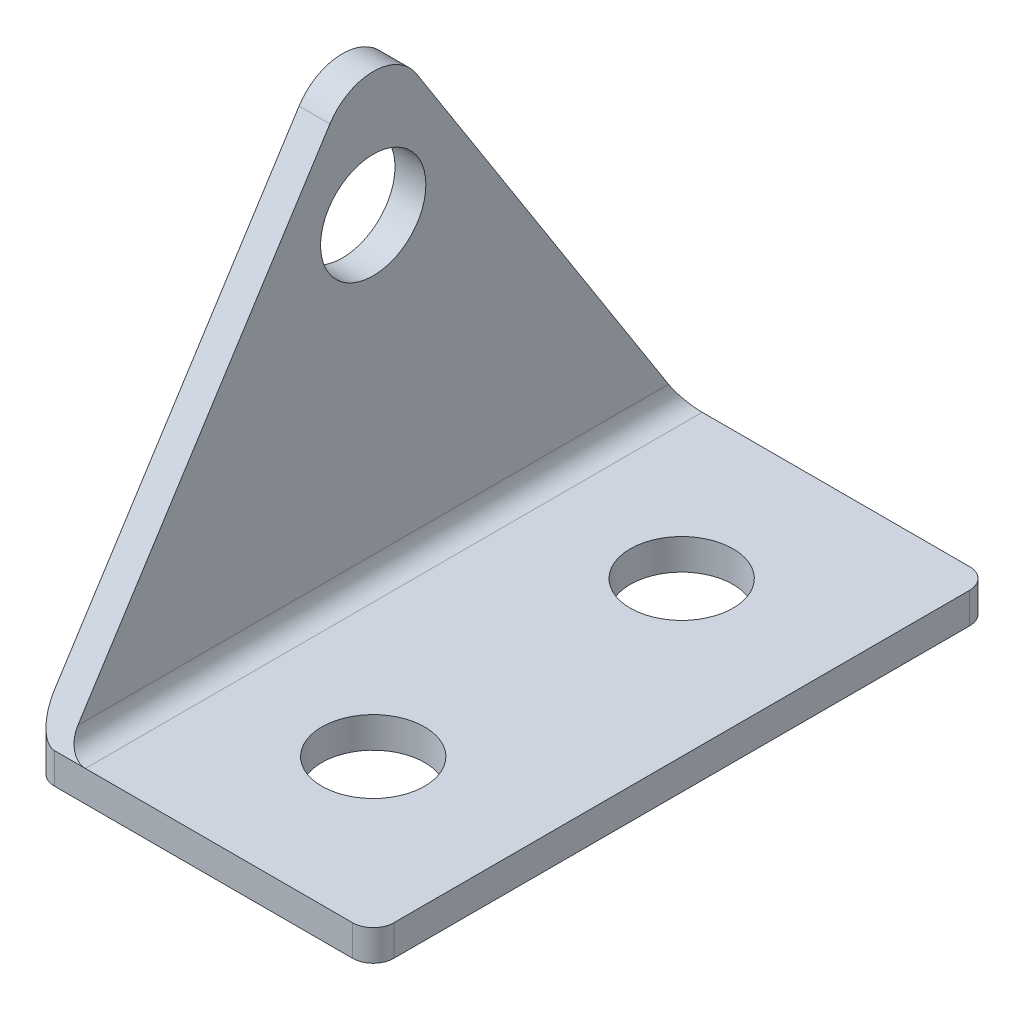
from build123d import *

# Parameters (mm, degrees)
BOSS_EXTRUDE1_DEPTH = 38.1
CUT_EXTRUDE2_DEPTH  = 76.2
FILLET1_R           = 6.35
SKETCH10_W          = 21.59
SKETCH10_H          = 76.2
CUT_EXTRUDE3_DEPTH  = 76.2
FILLET2_R           = 2.54
FILLET3_R           = 2.54
SKETCH11_R          = 6.5024
CUT_EXTRUDE4_DEPTH  = 76.2
SKETCH12_R          = 6.35
CUT_EXTRUDE5_DEPTH  = 76.2


with BuildPart() as part:
    # Sketch7 → Boss-Extrude1 (new, symmetric)
    with BuildSketch(Plane.XY):
        Polygon((0, 0), (0, 63.5), (3.81, 63.5), (3.81, 3.81), (63.5, 3.81), (63.5, 0), align=None)
    extrude(amount=BOSS_EXTRUDE1_DEPTH, both=True)

    # Sketch8 → Cut-Extrude2 (cut)
    with BuildSketch(Plane(origin=(3.81, 0, 0), x_dir=(0, 0, -1), z_dir=(1, 0, 0))):
        Polygon((-38.1, 63.5), (-38.1, 3.81), (0, 63.5), align=None)
        Polygon((38.1, 63.5), (0, 63.5), (38.1, 3.81), align=None)
    extrude(amount=-CUT_EXTRUDE2_DEPTH, mode=Mode.SUBTRACT)

    # Fillet1
    fillet1_edges = [part.edges().sort_by_distance(p)[0] for p in [
        (1.905, 63.5, 0),
    ]]
    fillet(fillet1_edges, radius=FILLET1_R)

    # Sketch10 → Cut-Extrude3 (cut)
    with BuildSketch(Plane(origin=(0, 3.81, 0), x_dir=(1, 0, 0), z_dir=(0, 1, 0))):
        with Locations((52.705, 0)):
            Rectangle(SKETCH10_W, SKETCH10_H)
    extrude(amount=-CUT_EXTRUDE3_DEPTH, mode=Mode.SUBTRACT)

    # Fillet2
    fillet2_edges = [part.edges().sort_by_distance(p)[0] for p in [
        (0, 1.905, 38.1),
        (0, 1.905, -38.1),
        (41.91, 1.905, -38.1),
        (41.91, 1.905, 38.1),
    ]]
    fillet(fillet2_edges, radius=FILLET2_R)

    # Fillet3
    fillet3_edges = [part.edges().sort_by_distance(p)[0] for p in [
        (3.81, 3.81, 0),
    ]]
    fillet(fillet3_edges, radius=FILLET3_R)

    # Sketch11 → Cut-Extrude4 (cut)
    with BuildSketch(Plane(origin=(3.81, 0, 0), x_dir=(0, 0, -1), z_dir=(1, 0, 0))):
        with Locations((0, 42.692021475)):
            Circle(SKETCH11_R)
    extrude(amount=-CUT_EXTRUDE4_DEPTH, mode=Mode.SUBTRACT)

    # Sketch12 → Cut-Extrude5 (cut)
    with BuildSketch(Plane(origin=(0, 3.81, 0), x_dir=(1, 0, 0), z_dir=(0, 1, 0))):
        with Locations(Location((22.86, 19.05, 0), (0, 0, 180))):
            Circle(SKETCH12_R)
        with Locations(Location((22.86, -19.05, 0), (0, 0, 180))):
            Circle(SKETCH12_R)
    extrude(amount=-CUT_EXTRUDE5_DEPTH, mode=Mode.SUBTRACT)


solid = part.part
